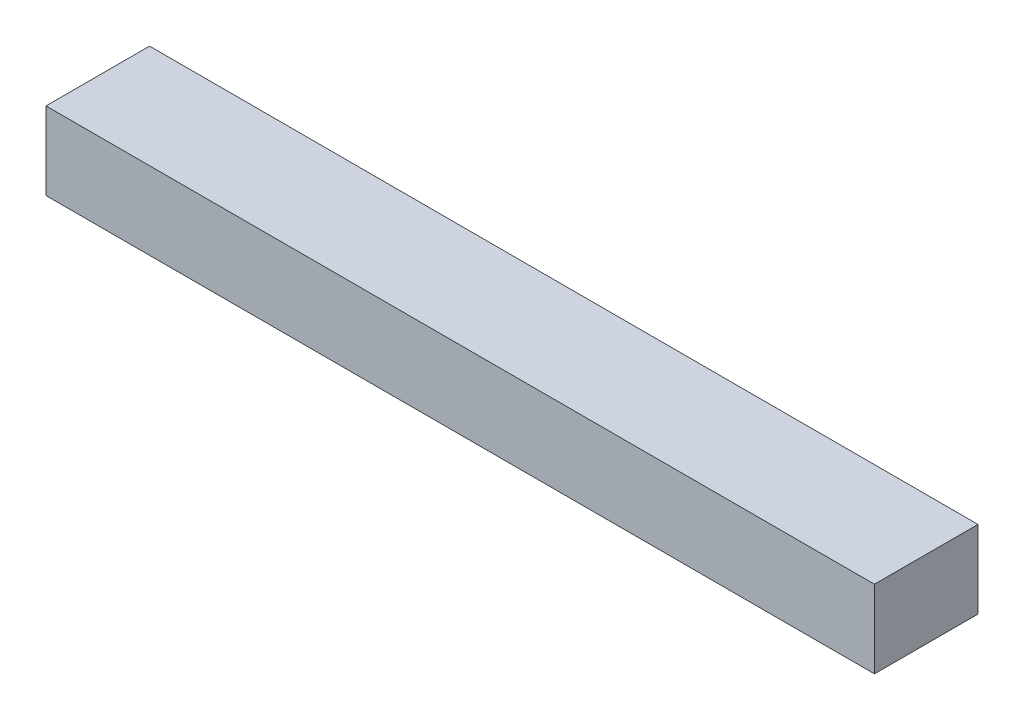
from build123d import *

# Parameters (mm, degrees)
SKETCH_1_W      = 128
SKETCH_1_H      = 12
EXTRUDE_1_DEPTH = 16


with BuildPart() as part:
    # 草图1 → 凸台-拉伸1 (new body)
    with BuildSketch(Plane.XY):
        Rectangle(SKETCH_1_W, SKETCH_1_H)
    extrude(amount=-EXTRUDE_1_DEPTH)


solid = part.part
